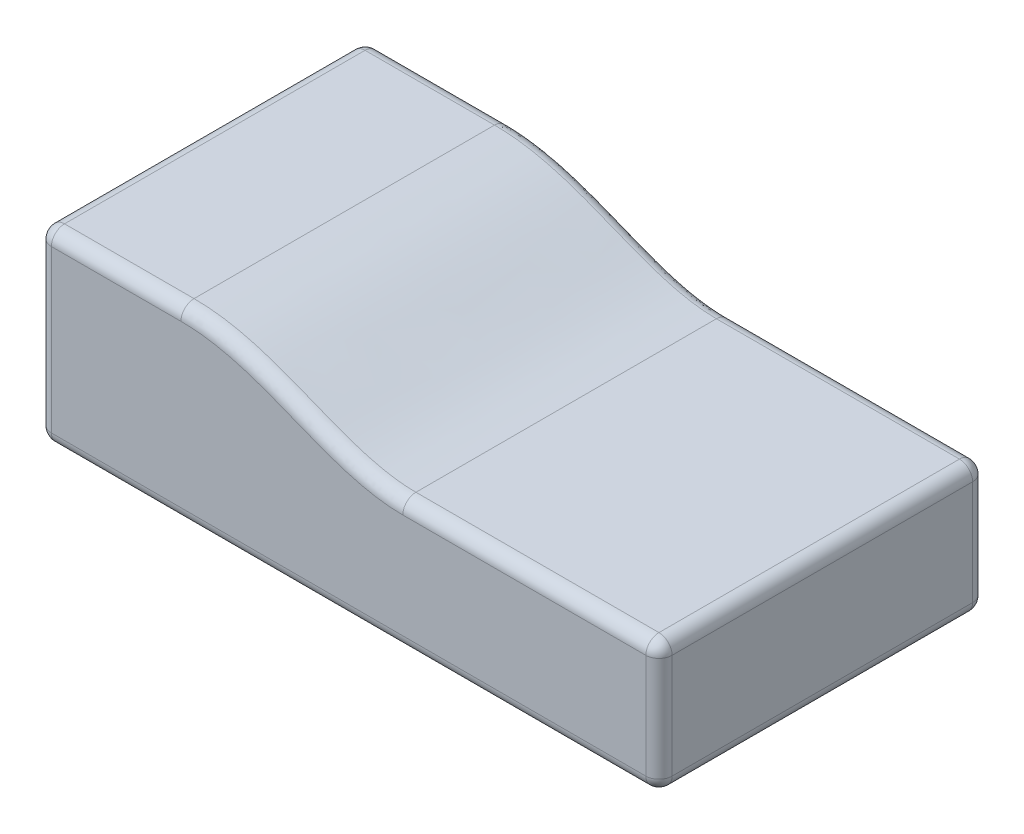
from build123d import *

# Parameters (mm, degrees)
SKETCH2_W               = 47.3
SKETCH2_H               = 24.9
BOSS_EXTRUDE1_DEPTH     = 14.3
CUT_EXTRUDE1_DEPTH      = 38.199764784
CUT_EXTRUDE1_DEPTH_BACK = 38.199764784
FILLET1_R               = 1


with BuildPart() as part:
    # Sketch2 → Boss-Extrude1 (new body)
    with BuildSketch(Plane(origin=(0, 0, 0), x_dir=(1, 0, 0), z_dir=(0, 1, 0))):
        Rectangle(SKETCH2_W, SKETCH2_H)
    extrude(amount=-BOSS_EXTRUDE1_DEPTH)

    # Sketch3 → Cut-Extrude1 (cut, two sides: drawn at the far end of the back side and taken through both)
    with BuildSketch(Plane(origin=(0, 0, -12.45), x_dir=(-1, 0, 0), z_dir=(0, 0, -1)).offset(-CUT_EXTRUDE1_DEPTH_BACK)):
        with BuildLine():
            Line((-23.65, -4.326263992), (-4.128269017, -4.326263992))
            add(Edge.make_bspline(
                [(-4.128269017, -4.326263992), (1.486176846, -4.326263992), (6.258882745, 0), (12.779413221, 0)],
                knots=[0, 0, 0, 0, 1, 1, 1, 1], degree=3))
            Line((12.779413221, 0), (-23.65, 0))
            Line((-23.65, 0), (-23.65, -4.326263992))
        make_face()
    extrude(amount=CUT_EXTRUDE1_DEPTH + CUT_EXTRUDE1_DEPTH_BACK, mode=Mode.SUBTRACT)

    # Fillet1
    fillet1_edges = [part.edges().sort_by_distance(p)[0] for p in [
        (-23.65, -14.3, 0),
        (-23.65, 0, 0),
        (-18.214706611, 0, -12.45),
        (-23.65, -7.15, -12.45),
        (0, -14.3, -12.45),
        (13.889134509, -4.326263992, -12.45),
        (-4.294045932, -2.040368807, -12.45),
        (23.65, -9.313131996, -12.45),
        (23.65, -14.3, 0),
        (23.65, -4.326263992, 0),
        (13.889134509, -4.326263992, 12.45),
        (23.65, -9.313131996, 12.45),
        (0, -14.3, 12.45),
        (-23.65, -7.15, 12.45),
        (-18.214706611, 0, 12.45),
        (-4.294045921, -2.040368812, 12.45),
    ]]
    fillet(fillet1_edges, radius=FILLET1_R)


solid = part.part
